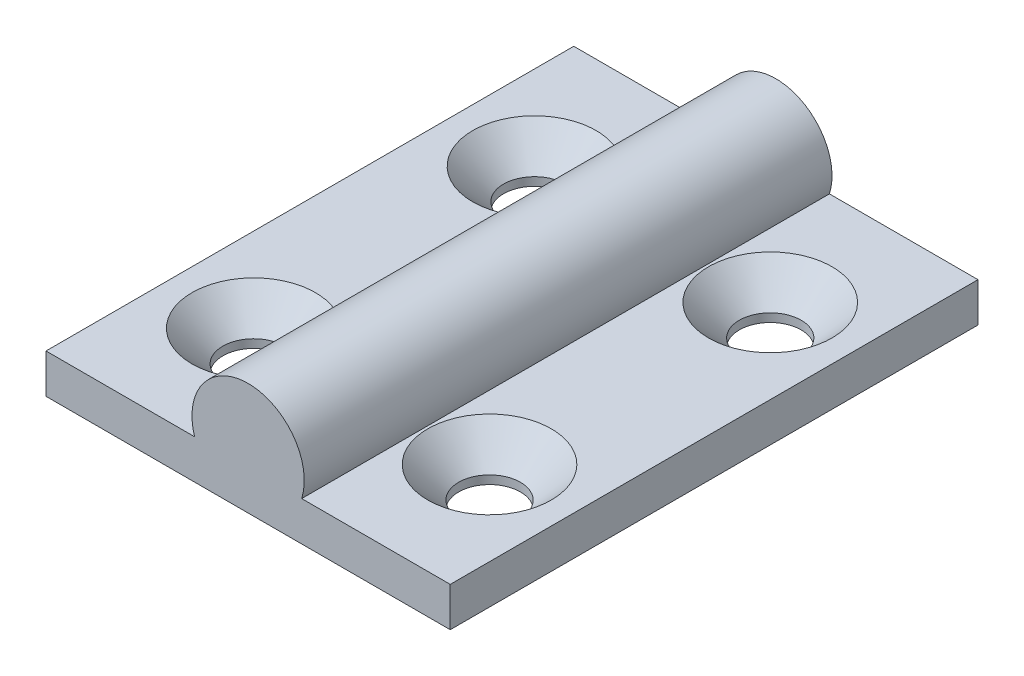
from build123d import *

# Parameters (mm, degrees)
SKETCH1_R           = 5
BOSS_EXTRUDE1_DEPTH = 23.5
HOLE1_AT_2_COUNT    = 2
HOLE1_AT_2_PITCH    = 25


with BuildPart() as part:
    # Sketch1 → Boss-Extrude1 (new, symmetric)
    with BuildSketch(Plane.XY):
        with BuildLine():
            Line((-18, -5), (0, -5))
            ThreePointArc((0, -5), (-2.958039892, -4.031128874), (-4.769696007, -1.5))
            Line((-4.769696007, -1.5), (-18, -1.5))
            Line((-18, -1.5), (-18, -5))
        make_face()
        Circle(SKETCH1_R)
    boss_extrude1 = extrude(amount=BOSS_EXTRUDE1_DEPTH, both=True)

    # Sketch5 → Hole1 (revolve, cut)
    with BuildSketch(Plane(origin=(-10.5, -1.5, -12.5), x_dir=(0, 0, 1), z_dir=(1, 0, 0))):
        Polygon((0, 0), (0, 5.152366702), (2.75, 3.5), (2.75, 2.75), (5.5, 0), align=None)
    hole1 = revolve(axis=Axis((-10.5, 12.808894879, -12.5), (0, -1, 0)), mode=Mode.SUBTRACT)

    # Hole1 at 2: Hole1 ×2
    with Locations(*[(0, 0, i * HOLE1_AT_2_PITCH) for i in range(1, HOLE1_AT_2_COUNT)]):
        add(hole1, mode=Mode.SUBTRACT)

    # Mirror1: Boss-Extrude1 across plane
    add(boss_extrude1.mirror(Plane(origin=(0, 0, 0), x_dir=(0, 0, 1), z_dir=(1, 0, 0))))

    # Mirror2: Hole1 across plane
    add(hole1.mirror(Plane(origin=(0, 0, 0), x_dir=(0, 0, 1), z_dir=(1, 0, 0))), mode=Mode.SUBTRACT)

    # Mirror2 copy 1 sketch → Mirror2 copy 1 (revolve, cut)
    with BuildSketch(Plane(origin=(10.5, -1.5, 12.5), x_dir=(0, 0, 1), z_dir=(-1, 0, 0))):
        Polygon((0, 0), (0, -5.152366702), (2.75, -3.5), (2.75, -2.75), (5.5, 0), align=None)
    revolve(axis=Axis((10.5, 12.808894879, 12.5), (0, 1, 0)), mode=Mode.SUBTRACT)


solid = part.part
